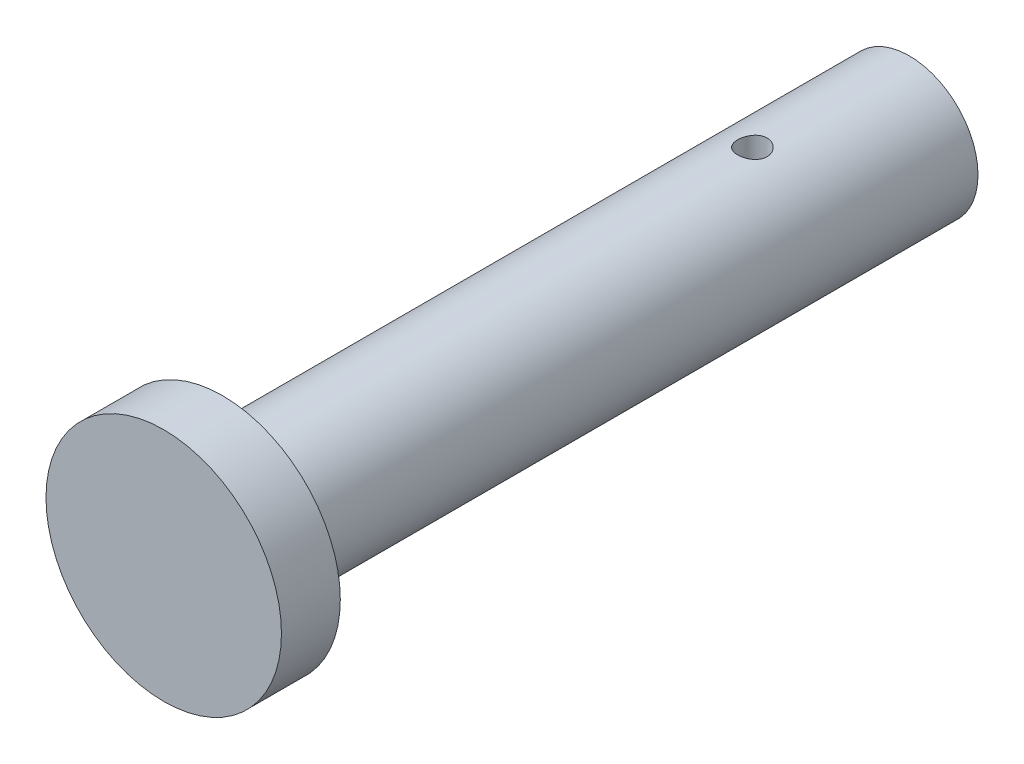
from build123d import *

# Parameters (mm, degrees)
SKETCH1_R           = 3.5
BOSS_EXTRUDE1_DEPTH = 35
CUT_EXTRUDE1_START  = 10
SKETCH3_R           = 0.75
CUT_EXTRUDE1_DEPTH  = 20
SKETCH4_R           = 6
BOSS_EXTRUDE2_DEPTH = 3


with BuildPart() as part:
    # Sketch1 → Boss-Extrude1 (new body)
    with BuildSketch(Plane.XY):
        Circle(SKETCH1_R)
    extrude(amount=BOSS_EXTRUDE1_DEPTH)

    # Sketch3 → Cut-Extrude1 (cut)
    with BuildSketch(Plane(origin=(0, 0, 0), x_dir=(1, 0, 0), z_dir=(0, 1, 0)).offset(CUT_EXTRUDE1_START)):
        with Locations(Location((0, -8, 0), (0, 0, 270))):
            Circle(SKETCH3_R)
    extrude(amount=-CUT_EXTRUDE1_DEPTH, mode=Mode.SUBTRACT)

    # Sketch4 → Boss-Extrude2 (add)
    with BuildSketch(Plane.XY.offset(35)):
        Circle(SKETCH4_R)
    extrude(amount=BOSS_EXTRUDE2_DEPTH)


solid = part.part
